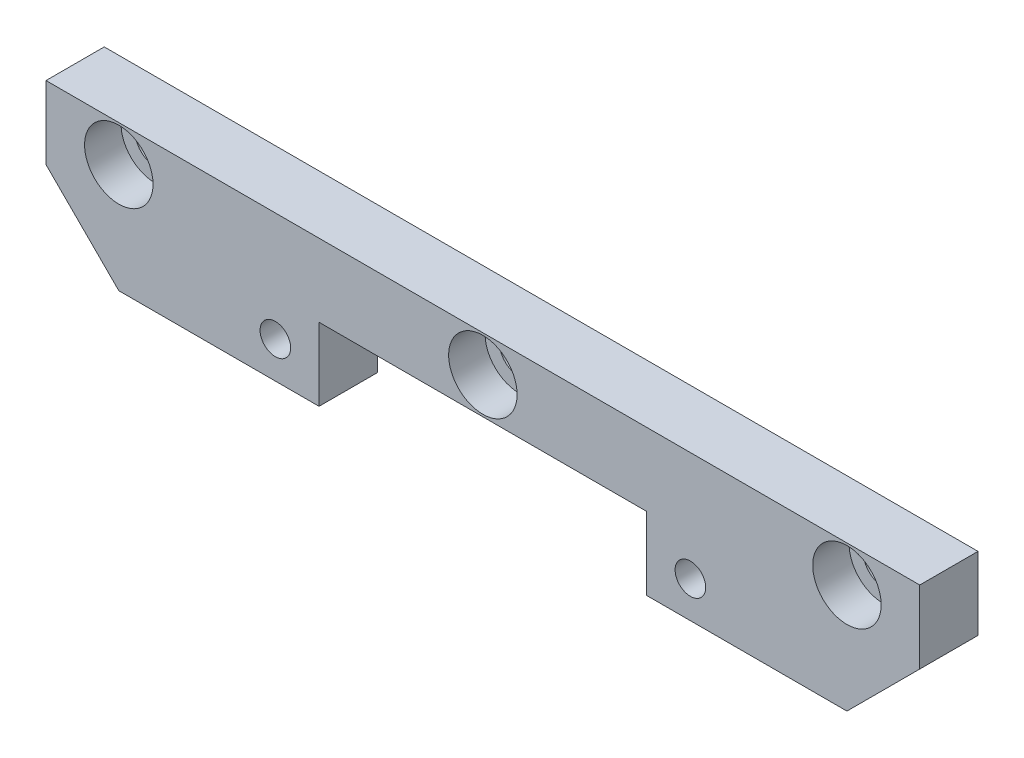
from build123d import *

# Parameters (mm, degrees)
SKETCH_1_W                = 120
SKETCH_1_H                = 20
EXTRUDE_1_DEPTH           = 4
HOLE_WIZARD_1_D           = 5.5
HOLE_WIZARD_1_CBORE_D     = 9.4
HOLE_WIZARD_1_CBORE_DEPTH = 5
HOLE_WIZARD_M5_2_D        = 4.2
SKETCH_6_W                = 45
SKETCH_6_H                = 10
CUT_EXTRUDE_1_DEPTH       = 62.351446601
CHAMFER_1_SIZE            = 10


with BuildPart() as part:
    # 草图1 → 凸台-拉伸1 (new, symmetric)
    with BuildSketch(Plane.XY):
        Rectangle(SKETCH_1_W, SKETCH_1_H)
    extrude(amount=EXTRUDE_1_DEPTH, both=True)

    # 打孔尺寸根据内六角圆柱头螺钉的类型1 (through all)
    with Locations(Plane(origin=(-5.332284739, -2.419582529, 4), x_dir=(1, 0, 0), z_dir=(0, 0, 1))):
        with Locations((-44.667715261, 7.419582529), (55.332284739, 7.419582529), (5.332284739, 7.419582529)):
            CounterBoreHole(HOLE_WIZARD_1_D / 2, HOLE_WIZARD_1_CBORE_D / 2, HOLE_WIZARD_1_CBORE_DEPTH)

    # M5 螺纹孔2 (through all)
    with Locations(Plane.XY.offset(4)):
        with Locations((-28.5, -5), (28.5, -5)):
            Hole(HOLE_WIZARD_M5_2_D / 2)

    # 草图6 → 切除-拉伸1 (cut, through all)
    with BuildSketch(Plane.XY.offset(4)):
        with Locations((0, -5)):
            Rectangle(SKETCH_6_W, SKETCH_6_H)
    extrude(amount=-CUT_EXTRUDE_1_DEPTH, mode=Mode.SUBTRACT)

    # 倒角1
    chamfer_1_edges = [part.edges().sort_by_distance(p)[0] for p in [
        (60, -10, 0),
        (-60, -10, 0),
    ]]
    chamfer(chamfer_1_edges, length=CHAMFER_1_SIZE)


solid = part.part
